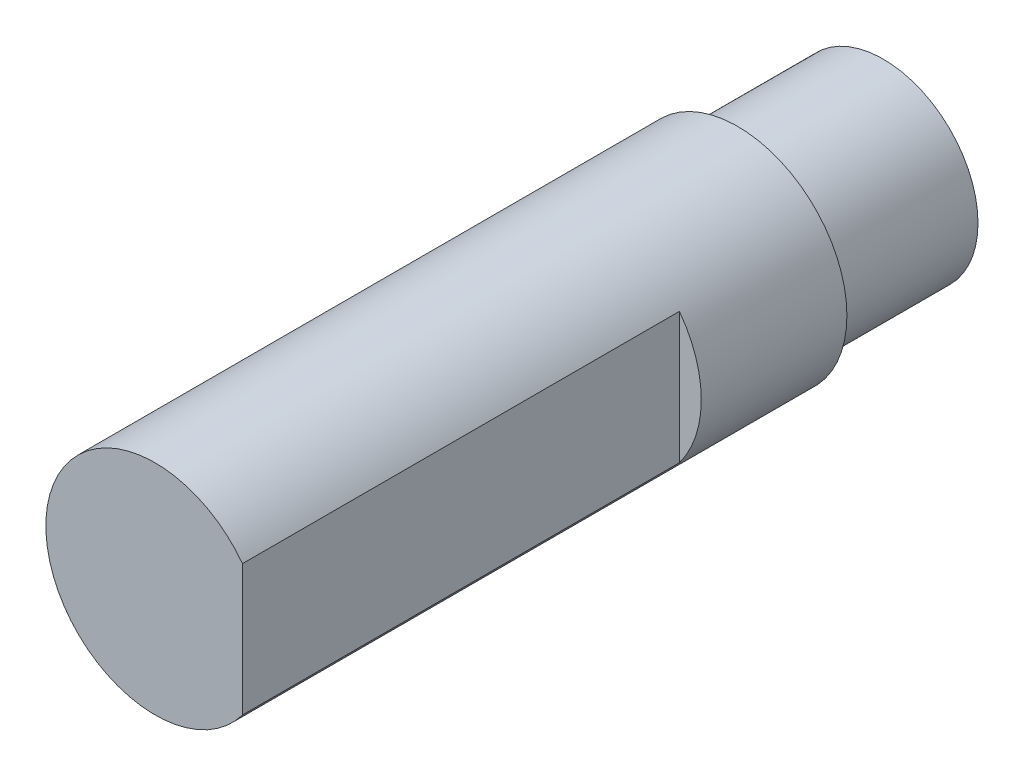
from build123d import *

# Parameters (mm, degrees)
F_01_START                              = 6
S01_OUTPUT_SHAFT_R                      = 3
F_01_OUTPUT_SHAFT_DEPTH                 = 16
F_02_START                              = 10
S02_D_FLAT_ON_EXPOSED_TIP_W             = 1.6
S02_D_FLAT_ON_EXPOSED_TIP_H             = 8
F_02_D_FLAT_ON_EXPOSED_TIP_DEPTH        = 12.2
F_03_START                              = 2
S03_OUTPUT_PILOT_IN_GEARBOX_NOSE_R      = 2.6
F_03_OUTPUT_PILOT_IN_GEARBOX_NOSE_DEPTH = 4


with BuildPart() as part:
    # S01 - Output shaft → 01 - Output shaft (new body)
    with BuildSketch(Plane.XY.offset(F_01_START)):
        Circle(S01_OUTPUT_SHAFT_R)
    extrude(amount=F_01_OUTPUT_SHAFT_DEPTH)

    # S02 - D flat on exposed tip → 02 - D flat on exposed tip (cut)
    with BuildSketch(Plane.XY.offset(F_02_START)):
        with Locations((3.2, 0)):
            Rectangle(S02_D_FLAT_ON_EXPOSED_TIP_W, S02_D_FLAT_ON_EXPOSED_TIP_H)
    extrude(amount=F_02_D_FLAT_ON_EXPOSED_TIP_DEPTH, mode=Mode.SUBTRACT)

    # S03 - Output pilot in gearbox nose → 03 - Output pilot in gearbox nose (add)
    with BuildSketch(Plane.XY.offset(F_03_START)):
        Circle(S03_OUTPUT_PILOT_IN_GEARBOX_NOSE_R)
    extrude(amount=F_03_OUTPUT_PILOT_IN_GEARBOX_NOSE_DEPTH)


solid = part.part
